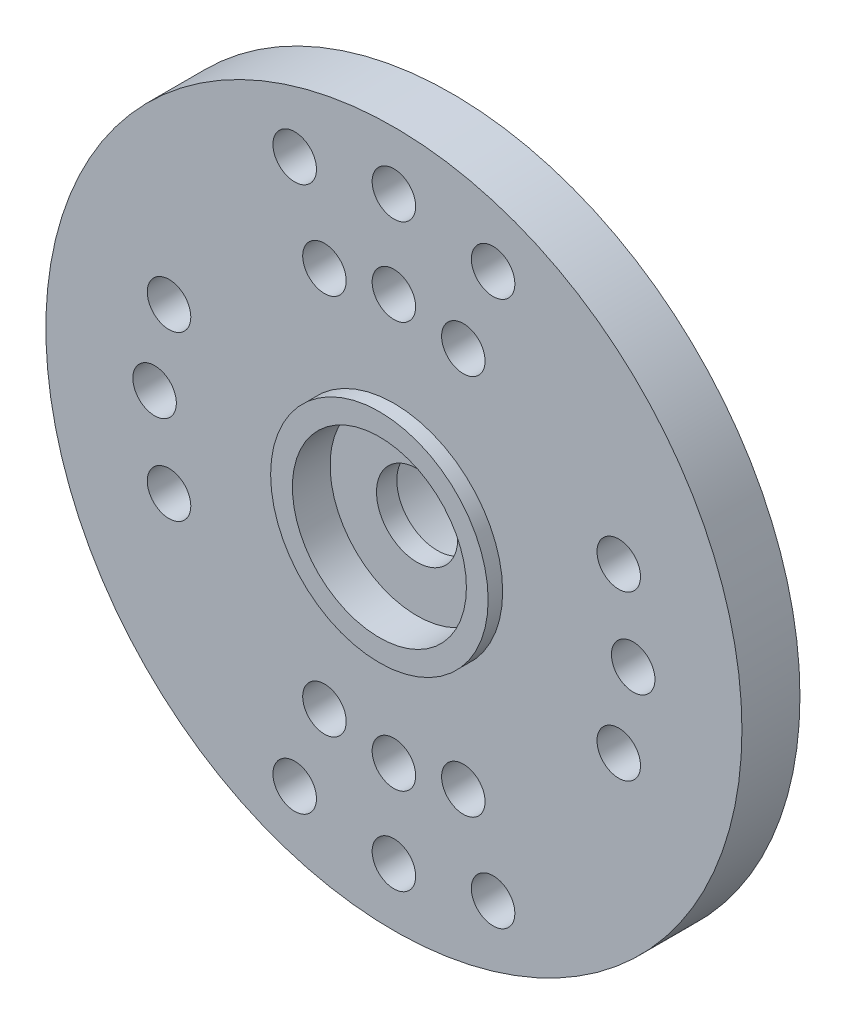
from build123d import *

# Parameters (mm, degrees)
SKETCH_2_R          = 0.75
CUT_EXTRUDE_1_DEPTH = 18.557049866


with BuildPart() as part:
    # Эскиз1 → Повернуть1 (revolve)
    with BuildSketch(Plane(origin=(0, 0, 0), x_dir=(0, 0, -1), z_dir=(1, 0, 0)), mode=Mode.PRIVATE) as revolve_1_sk:
        Polygon((0, 3.75), (0, 12), (2, 12), (2, 4.5), (4.5, 4.5), (4.5, 3), (1.5, 3), (1.5, 1.4), (0.8, 1.4), (0.8, 3), (-0.5, 3), (-0.5, 3.75), align=None)
    revolve(revolve_1_sk.sketch.rotate(Axis((0, 0, 50), (0, 0, -1)), 90), axis=Axis((0, 0, 50), (0, 0, -1)))

    # Эскиз2 → Вырез-Вытянуть1 (cut, through all)
    with BuildSketch(Plane.XY):
        with Locations((8.25, 0)):
            Circle(SKETCH_2_R)
        with Locations((7.752464121, -2.821666182)):
            Circle(SKETCH_2_R)
        with Locations((7.752464121, 2.821666182)):
            Circle(SKETCH_2_R)
        with Locations((-8.25, 0)):
            Circle(SKETCH_2_R)
        with Locations((-7.752464121, -2.821666182)):
            Circle(SKETCH_2_R)
        with Locations((-7.752464121, 2.821666182)):
            Circle(SKETCH_2_R)
        with Locations((0, 7)):
            Circle(SKETCH_2_R)
        with Locations((0, 10)):
            Circle(SKETCH_2_R)
        with Locations((2.394141003, 6.577848346)):
            Circle(SKETCH_2_R)
        with Locations((3.420201433, 9.396926208)):
            Circle(SKETCH_2_R)
        with Locations((-2.394141003, 6.577848346)):
            Circle(SKETCH_2_R)
        with Locations((-3.420201433, 9.396926208)):
            Circle(SKETCH_2_R)
        with Locations((0, -7)):
            Circle(SKETCH_2_R)
        with Locations((0, -10)):
            Circle(SKETCH_2_R)
        with Locations((3.420201433, -9.396926208)):
            Circle(SKETCH_2_R)
        with Locations((2.394141003, -6.577848346)):
            Circle(SKETCH_2_R)
        with Locations((-2.394141003, -6.577848346)):
            Circle(SKETCH_2_R)
        with Locations((-3.420201433, -9.396926208)):
            Circle(SKETCH_2_R)
    extrude(amount=-CUT_EXTRUDE_1_DEPTH, mode=Mode.SUBTRACT)


solid = part.part
